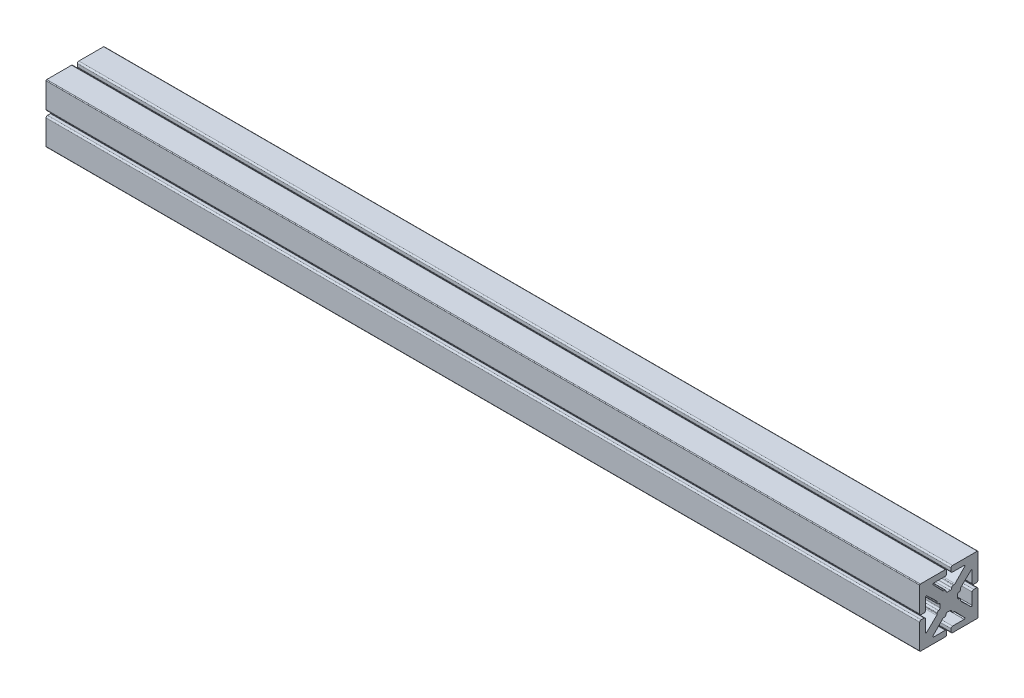
from build123d import *

# Parameters (mm, degrees)
BOSS_EXTRUDE1_DEPTH = 2.54
SCALE1_SCALE        = 8
BOSS_EXTRUDE2_DEPTH = 600


with BuildPart() as part:
    # Sketch1 → Boss-Extrude1 (new body)
    with BuildSketch(Plane(origin=(0, 0, 0), x_dir=(0, 0, -1), z_dir=(1, 0, 0))):
        with BuildLine():
            Line((-0.2413, 1.4986), (0.2413, 1.4986))
            ThreePointArc((0.2413, 1.4986), (0.420905122, 1.572994878), (0.4953, 1.7526))
            ThreePointArc((0.4953, 1.7526), (0.569694878, 1.932205122), (0.7493, 2.0066))
            Line((0.7493, 2.0066), (0.882498635, 2.0066))
            ThreePointArc((0.882498635, 2.0066), (0.981966313, 2.026886113), (1.065545703, 2.084504086))
            Line((1.065545703, 2.084504086), (2.714118421, 3.798152043))
            ThreePointArc((2.714118421, 3.798152043), (2.739451831, 3.935933839), (2.622594887, 4.0132))
            Line((2.622594887, 4.0132), (0.635, 4.0132))
            ThreePointArc((0.635, 4.0132), (0.455394878, 4.087594878), (0.381, 4.2672))
            Line((0.381, 4.2672), (0.381, 4.7498))
            ThreePointArc((0.381, 4.7498), (0.455394878, 4.929405122), (0.635, 5.0038))
            Line((0.635, 5.0038), (4.8768, 5.0038))
            ThreePointArc((4.8768, 5.0038), (4.966602561, 4.966602561), (5.0038, 4.8768))
            Line((5.0038, 4.8768), (5.0038, 0.635))
            ThreePointArc((5.0038, 0.635), (4.929405122, 0.455394878), (4.7498, 0.381))
            Line((4.7498, 0.381), (4.2672, 0.381))
            ThreePointArc((4.2672, 0.381), (4.087594878, 0.455394878), (4.0132, 0.635))
            Line((4.0132, 0.635), (4.0132, 2.622594887))
            ThreePointArc((4.0132, 2.622594887), (3.935933839, 2.739451831), (3.798152043, 2.714118421))
            Line((3.798152043, 2.714118421), (2.084504086, 1.065545703))
            ThreePointArc((2.084504086, 1.065545703), (2.026886113, 0.981966313), (2.0066, 0.882498635))
            Line((2.0066, 0.882498635), (2.0066, 0.7493))
            ThreePointArc((2.0066, 0.7493), (1.932205122, 0.569694878), (1.7526, 0.4953))
            ThreePointArc((1.7526, 0.4953), (1.572994878, 0.420905122), (1.4986, 0.2413))
            Line((1.4986, 0.2413), (1.4986, -0.2413))
            ThreePointArc((1.4986, -0.2413), (1.572994878, -0.420905122), (1.7526, -0.4953))
            ThreePointArc((1.7526, -0.4953), (1.932205122, -0.569694878), (2.0066, -0.7493))
            Line((2.0066, -0.7493), (2.0066, -0.882498635))
            ThreePointArc((2.0066, -0.882498635), (2.026886113, -0.981966313), (2.084504086, -1.065545703))
            Line((2.084504086, -1.065545703), (3.798152043, -2.714118421))
            ThreePointArc((3.798152043, -2.714118421), (3.935933839, -2.739451831), (4.0132, -2.622594887))
            Line((4.0132, -2.622594887), (4.0132, -0.635))
            ThreePointArc((4.0132, -0.635), (4.087594878, -0.455394878), (4.2672, -0.381))
            Line((4.2672, -0.381), (4.7498, -0.381))
            ThreePointArc((4.7498, -0.381), (4.929405122, -0.455394878), (5.0038, -0.635))
            Line((5.0038, -0.635), (5.0038, -4.8768))
            ThreePointArc((5.0038, -4.8768), (4.966602561, -4.966602561), (4.8768, -5.0038))
            Line((4.8768, -5.0038), (0.635, -5.0038))
            ThreePointArc((0.635, -5.0038), (0.455394878, -4.929405122), (0.381, -4.7498))
            Line((0.381, -4.7498), (0.381, -4.2672))
            ThreePointArc((0.381, -4.2672), (0.455394878, -4.087594878), (0.635, -4.0132))
            Line((0.635, -4.0132), (2.622594887, -4.0132))
            ThreePointArc((2.622594887, -4.0132), (2.739451831, -3.935933839), (2.714118421, -3.798152043))
            Line((2.714118421, -3.798152043), (1.065545703, -2.084504086))
            ThreePointArc((1.065545703, -2.084504086), (0.981966313, -2.026886113), (0.882498635, -2.0066))
            Line((0.882498635, -2.0066), (0.7493, -2.0066))
            ThreePointArc((0.7493, -2.0066), (0.569694878, -1.932205122), (0.4953, -1.7526))
            ThreePointArc((0.4953, -1.7526), (0.420905122, -1.572994878), (0.2413, -1.4986))
            Line((0.2413, -1.4986), (-0.2413, -1.4986))
            ThreePointArc((-0.2413, -1.4986), (-0.420905122, -1.572994878), (-0.4953, -1.7526))
            ThreePointArc((-0.4953, -1.7526), (-0.569694878, -1.932205122), (-0.7493, -2.0066))
            Line((-0.7493, -2.0066), (-0.882498635, -2.0066))
            ThreePointArc((-0.882498635, -2.0066), (-0.981966313, -2.026886113), (-1.065545703, -2.084504086))
            Line((-1.065545703, -2.084504086), (-2.714118421, -3.798152043))
            ThreePointArc((-2.714118421, -3.798152043), (-2.739451831, -3.935933839), (-2.622594887, -4.0132))
            Line((-2.622594887, -4.0132), (-0.635, -4.0132))
            ThreePointArc((-0.635, -4.0132), (-0.455394878, -4.087594878), (-0.381, -4.2672))
            Line((-0.381, -4.2672), (-0.381, -4.7498))
            ThreePointArc((-0.381, -4.7498), (-0.455394878, -4.929405122), (-0.635, -5.0038))
            Line((-0.635, -5.0038), (-4.8768, -5.0038))
            ThreePointArc((-4.8768, -5.0038), (-4.966602561, -4.966602561), (-5.0038, -4.8768))
            Line((-5.0038, -4.8768), (-5.0038, -0.635))
            ThreePointArc((-5.0038, -0.635), (-4.929405122, -0.455394878), (-4.7498, -0.381))
            Line((-4.7498, -0.381), (-4.2672, -0.381))
            ThreePointArc((-4.2672, -0.381), (-4.087594878, -0.455394878), (-4.0132, -0.635))
            Line((-4.0132, -0.635), (-4.0132, -2.622594887))
            ThreePointArc((-4.0132, -2.622594887), (-3.935933839, -2.739451831), (-3.798152043, -2.714118421))
            Line((-3.798152043, -2.714118421), (-2.084504086, -1.065545703))
            ThreePointArc((-2.084504086, -1.065545703), (-2.026886113, -0.981966313), (-2.0066, -0.882498635))
            Line((-2.0066, -0.882498635), (-2.0066, -0.7493))
            ThreePointArc((-2.0066, -0.7493), (-1.932205122, -0.569694878), (-1.7526, -0.4953))
            ThreePointArc((-1.7526, -0.4953), (-1.572994878, -0.420905122), (-1.4986, -0.2413))
            Line((-1.4986, -0.2413), (-1.4986, 0.2413))
            ThreePointArc((-1.4986, 0.2413), (-1.572994878, 0.420905122), (-1.7526, 0.4953))
            ThreePointArc((-1.7526, 0.4953), (-1.932205122, 0.569694878), (-2.0066, 0.7493))
            Line((-2.0066, 0.7493), (-2.0066, 0.882498635))
            ThreePointArc((-2.0066, 0.882498635), (-2.026886113, 0.981966313), (-2.084504086, 1.065545703))
            Line((-2.084504086, 1.065545703), (-3.798152043, 2.714118421))
            ThreePointArc((-3.798152043, 2.714118421), (-3.935933839, 2.739451831), (-4.0132, 2.622594887))
            Line((-4.0132, 2.622594887), (-4.0132, 0.635))
            ThreePointArc((-4.0132, 0.635), (-4.087594878, 0.455394878), (-4.2672, 0.381))
            Line((-4.2672, 0.381), (-4.7498, 0.381))
            ThreePointArc((-4.7498, 0.381), (-4.929405122, 0.455394878), (-5.0038, 0.635))
            Line((-5.0038, 0.635), (-5.0038, 4.8768))
            ThreePointArc((-5.0038, 4.8768), (-4.966602561, 4.966602561), (-4.8768, 5.0038))
            Line((-4.8768, 5.0038), (-0.635, 5.0038))
            ThreePointArc((-0.635, 5.0038), (-0.455394878, 4.929405122), (-0.381, 4.7498))
            Line((-0.381, 4.7498), (-0.381, 4.2672))
            ThreePointArc((-0.381, 4.2672), (-0.455394878, 4.087594878), (-0.635, 4.0132))
            Line((-0.635, 4.0132), (-2.622594887, 4.0132))
            ThreePointArc((-2.622594887, 4.0132), (-2.739451831, 3.935933839), (-2.714118421, 3.798152043))
            Line((-2.714118421, 3.798152043), (-1.065545703, 2.084504086))
            ThreePointArc((-1.065545703, 2.084504086), (-0.981966313, 2.026886113), (-0.882498635, 2.0066))
            Line((-0.882498635, 2.0066), (-0.7493, 2.0066))
            ThreePointArc((-0.7493, 2.0066), (-0.569694878, 1.932205122), (-0.4953, 1.7526))
            ThreePointArc((-0.4953, 1.7526), (-0.420905122, 1.572994878), (-0.2413, 1.4986))
        make_face()
    extrude(amount=BOSS_EXTRUDE1_DEPTH)


with BuildPart() as part_1:
    # Scale1: scaled about (1.27, 0, 0)
    add(part.part.scale(SCALE1_SCALE).moved(Location((-8.89, 0, 0))))

    # Sketch2 → Boss-Extrude2 (add, symmetric)
    with BuildSketch(Plane(origin=(0, 0, 0), x_dir=(0, 0, -1), z_dir=(1, 0, 0))):
        with BuildLine():
            Line((-37.9984, 3.048), (-34.1376, 3.048))
            ThreePointArc((-34.1376, 3.048), (-32.700759021, 3.643159021), (-32.1056, 5.08))
            Line((-32.1056, 5.08), (-32.1056, 20.980759097))
            ThreePointArc((-32.1056, 20.980759097), (-31.487470712, 21.915614646), (-30.385216345, 21.71294737))
            Line((-30.385216345, 21.71294737), (-16.67603269, 8.524365626))
            ThreePointArc((-16.67603269, 8.524365626), (-16.215088903, 7.855730504), (-16.0528, 7.059989081))
            Line((-16.0528, 7.059989081), (-16.0528, 5.9944))
            ThreePointArc((-16.0528, 5.9944), (-15.457640979, 4.557559021), (-14.0208, 3.9624))
            ThreePointArc((-14.0208, 3.9624), (-12.583959021, 3.367240979), (-11.9888, 1.9304))
            Line((-11.9888, 1.9304), (-11.9888, -1.9304))
            ThreePointArc((-11.9888, -1.9304), (-12.583959021, -3.367240979), (-14.0208, -3.9624))
            ThreePointArc((-14.0208, -3.9624), (-15.457640979, -4.557559021), (-16.0528, -5.9944))
            Line((-16.0528, -5.9944), (-16.0528, -7.059989081))
            ThreePointArc((-16.0528, -7.059989081), (-16.215088903, -7.855730504), (-16.67603269, -8.524365626))
            Line((-16.67603269, -8.524365626), (-30.385216345, -21.71294737))
            ThreePointArc((-30.385216345, -21.71294737), (-31.487470712, -21.915614646), (-32.1056, -20.980759097))
            Line((-32.1056, -20.980759097), (-32.1056, -5.08))
            ThreePointArc((-32.1056, -5.08), (-32.700759021, -3.643159021), (-34.1376, -3.048))
            Line((-34.1376, -3.048), (-37.9984, -3.048))
            ThreePointArc((-37.9984, -3.048), (-39.435240979, -3.643159021), (-40.0304, -5.08))
            Line((-40.0304, -5.08), (-40.0304, -39.0144))
            ThreePointArc((-40.0304, -39.0144), (-39.73282049, -39.73282049), (-39.0144, -40.0304))
            Line((-39.0144, -40.0304), (-5.08, -40.0304))
            ThreePointArc((-5.08, -40.0304), (-3.643159021, -39.435240979), (-3.048, -37.9984))
            Line((-3.048, -37.9984), (-3.048, -34.1376))
            ThreePointArc((-3.048, -34.1376), (-3.643159021, -32.700759021), (-5.08, -32.1056))
            Line((-5.08, -32.1056), (-20.980759097, -32.1056))
            ThreePointArc((-20.980759097, -32.1056), (-21.915614646, -31.487470712), (-21.71294737, -30.385216345))
            Line((-21.71294737, -30.385216345), (-8.524365626, -16.67603269))
            ThreePointArc((-8.524365626, -16.67603269), (-7.855730504, -16.215088903), (-7.059989081, -16.0528))
            Line((-7.059989081, -16.0528), (-5.9944, -16.0528))
            ThreePointArc((-5.9944, -16.0528), (-4.557559021, -15.457640979), (-3.9624, -14.0208))
            ThreePointArc((-3.9624, -14.0208), (-3.367240979, -12.583959021), (-1.9304, -11.9888))
            Line((-1.9304, -11.9888), (1.9304, -11.9888))
            ThreePointArc((1.9304, -11.9888), (3.367240979, -12.583959021), (3.9624, -14.0208))
            ThreePointArc((3.9624, -14.0208), (4.557559021, -15.457640979), (5.9944, -16.0528))
            Line((5.9944, -16.0528), (7.059989081, -16.0528))
            ThreePointArc((7.059989081, -16.0528), (7.855730504, -16.215088903), (8.524365626, -16.67603269))
            Line((8.524365626, -16.67603269), (21.71294737, -30.385216345))
            ThreePointArc((21.71294737, -30.385216345), (21.915614646, -31.487470712), (20.980759097, -32.1056))
            Line((20.980759097, -32.1056), (5.08, -32.1056))
            ThreePointArc((5.08, -32.1056), (3.643159021, -32.700759021), (3.048, -34.1376))
            Line((3.048, -34.1376), (3.048, -37.9984))
            ThreePointArc((3.048, -37.9984), (3.643159021, -39.435240979), (5.08, -40.0304))
            Line((5.08, -40.0304), (39.0144, -40.0304))
            ThreePointArc((39.0144, -40.0304), (39.73282049, -39.73282049), (40.0304, -39.0144))
            Line((40.0304, -39.0144), (40.0304, -5.08))
            ThreePointArc((40.0304, -5.08), (39.435240979, -3.643159021), (37.9984, -3.048))
            Line((37.9984, -3.048), (34.1376, -3.048))
            ThreePointArc((34.1376, -3.048), (32.700759021, -3.643159021), (32.1056, -5.08))
            Line((32.1056, -5.08), (32.1056, -20.980759097))
            ThreePointArc((32.1056, -20.980759097), (31.487470712, -21.915614646), (30.385216345, -21.71294737))
            Line((30.385216345, -21.71294737), (16.67603269, -8.524365626))
            ThreePointArc((16.67603269, -8.524365626), (16.215088903, -7.855730504), (16.0528, -7.059989081))
            Line((16.0528, -7.059989081), (16.0528, -5.9944))
            ThreePointArc((16.0528, -5.9944), (15.457640979, -4.557559021), (14.0208, -3.9624))
            ThreePointArc((14.0208, -3.9624), (12.583959021, -3.367240979), (11.9888, -1.9304))
            Line((11.9888, -1.9304), (11.9888, 1.9304))
            ThreePointArc((11.9888, 1.9304), (12.583959021, 3.367240979), (14.0208, 3.9624))
            ThreePointArc((14.0208, 3.9624), (15.457640979, 4.557559021), (16.0528, 5.9944))
            Line((16.0528, 5.9944), (16.0528, 7.059989081))
            ThreePointArc((16.0528, 7.059989081), (16.215088903, 7.855730504), (16.67603269, 8.524365626))
            Line((16.67603269, 8.524365626), (30.385216345, 21.71294737))
            ThreePointArc((30.385216345, 21.71294737), (31.487470712, 21.915614646), (32.1056, 20.980759097))
            Line((32.1056, 20.980759097), (32.1056, 5.08))
            ThreePointArc((32.1056, 5.08), (32.700759021, 3.643159021), (34.1376, 3.048))
            Line((34.1376, 3.048), (37.9984, 3.048))
            ThreePointArc((37.9984, 3.048), (39.435240979, 3.643159021), (40.0304, 5.08))
            Line((40.0304, 5.08), (40.0304, 39.0144))
            ThreePointArc((40.0304, 39.0144), (39.73282049, 39.73282049), (39.0144, 40.0304))
            Line((39.0144, 40.0304), (5.08, 40.0304))
            ThreePointArc((5.08, 40.0304), (3.643159021, 39.435240979), (3.048, 37.9984))
            Line((3.048, 37.9984), (3.048, 34.1376))
            ThreePointArc((3.048, 34.1376), (3.643159021, 32.700759021), (5.08, 32.1056))
            Line((5.08, 32.1056), (20.980759097, 32.1056))
            ThreePointArc((20.980759097, 32.1056), (21.915614646, 31.487470712), (21.71294737, 30.385216345))
            Line((21.71294737, 30.385216345), (8.524365626, 16.67603269))
            ThreePointArc((8.524365626, 16.67603269), (7.855730504, 16.215088903), (7.059989081, 16.0528))
            Line((7.059989081, 16.0528), (5.9944, 16.0528))
            ThreePointArc((5.9944, 16.0528), (4.557559021, 15.457640979), (3.9624, 14.0208))
            ThreePointArc((3.9624, 14.0208), (3.367240979, 12.583959021), (1.9304, 11.9888))
            Line((1.9304, 11.9888), (-1.9304, 11.9888))
            ThreePointArc((-1.9304, 11.9888), (-3.367240979, 12.583959021), (-3.9624, 14.0208))
            ThreePointArc((-3.9624, 14.0208), (-4.557559021, 15.457640979), (-5.9944, 16.0528))
            Line((-5.9944, 16.0528), (-7.059989081, 16.0528))
            ThreePointArc((-7.059989081, 16.0528), (-7.855730504, 16.215088903), (-8.524365626, 16.67603269))
            Line((-8.524365626, 16.67603269), (-21.71294737, 30.385216345))
            ThreePointArc((-21.71294737, 30.385216345), (-21.915614646, 31.487470712), (-20.980759097, 32.1056))
            Line((-20.980759097, 32.1056), (-5.08, 32.1056))
            ThreePointArc((-5.08, 32.1056), (-3.643159021, 32.700759021), (-3.048, 34.1376))
            Line((-3.048, 34.1376), (-3.048, 37.9984))
            ThreePointArc((-3.048, 37.9984), (-3.643159021, 39.435240979), (-5.08, 40.0304))
            Line((-5.08, 40.0304), (-39.0144, 40.0304))
            ThreePointArc((-39.0144, 40.0304), (-39.73282049, 39.73282049), (-40.0304, 39.0144))
            Line((-40.0304, 39.0144), (-40.0304, 5.08))
            ThreePointArc((-40.0304, 5.08), (-39.435240979, 3.643159021), (-37.9984, 3.048))
        make_face()
    extrude(amount=BOSS_EXTRUDE2_DEPTH, both=True)


solid = part_1.part
